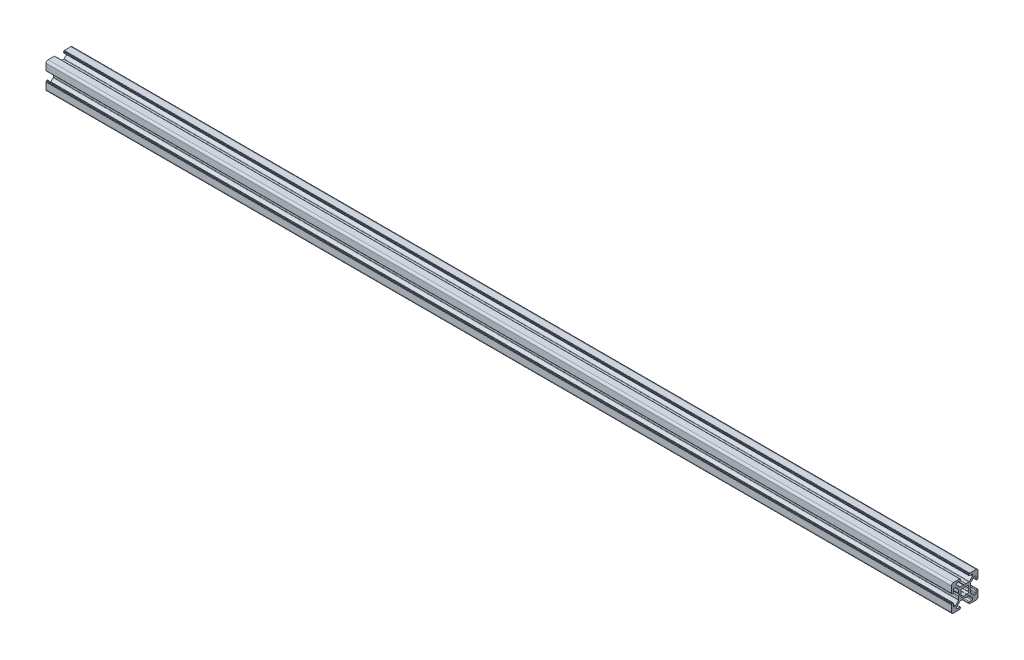
from build123d import *

# Parameters (mm, degrees)
METRIC_2020_1_DEPTH = 680


with BuildPart() as part:
    # Sketch11 → Metric 2020(1) (new body)
    with BuildSketch(Plane.YZ):
        with BuildLine():
            Line((-3.5, 8.499999673), (-5.500000686, 8.499999673))
            ThreePointArc((-5.500000686, 8.499999673), (-5.853554077, 8.353553064), (-6.000000686, 7.999999673))
            Line((-6.000000686, 7.999999673), (-6.000000686, 7.267766626))
            ThreePointArc((-6.000000686, 7.267766626), (-5.961940448, 7.076424899), (-5.853554059, 6.914213219))
            Line((-5.853554059, 6.914213219), (-3.585787212, 4.646446592))
            ThreePointArc((-3.585787212, 4.646446592), (-3.423575544, 4.538060229), (-3.232233839, 4.5))
            Line((-3.232233839, 4.5), (-0.953590312, 4.5))
            ThreePointArc((-0.953590312, 4.5), (-0.901826505, 4.493185166), (-0.853590316, 4.473205083))
            Line((-0.853590316, 4.473205083), (-0.100000045, 4.038119562))
            ThreePointArc((-0.100000045, 4.038119562), (0, 4.011324632), (0.100000045, 4.038119562))
            Line((0.100000045, 4.038119562), (0.853590316, 4.473205083))
            ThreePointArc((0.853590316, 4.473205083), (0.901826505, 4.493185166), (0.953590312, 4.5))
            Line((0.953590312, 4.5), (3.232233839, 4.5))
            ThreePointArc((3.232233839, 4.5), (3.423575544, 4.538060229), (3.585787212, 4.646446592))
            Line((3.585787212, 4.646446592), (5.853554059, 6.914213219))
            ThreePointArc((5.853554059, 6.914213219), (5.961940448, 7.076424899), (6.000000686, 7.267766626))
            Line((6.000000686, 7.267766626), (6.000000686, 7.999999673))
            ThreePointArc((6.000000686, 7.999999673), (5.853554077, 8.353553064), (5.500000686, 8.499999673))
            Line((5.500000686, 8.499999673), (3.5, 8.499999673))
            ThreePointArc((3.5, 8.499999673), (3.146446609, 8.646446283), (3, 8.999999673))
            Line((3, 8.999999673), (3, 9.3))
            ThreePointArc((3, 9.3), (3.058578644, 9.441421356), (3.2, 9.5))
            Line((3.2, 9.5), (3.350000228, 9.5))
            ThreePointArc((3.350000228, 9.5), (3.491421584, 9.558578644), (3.550000228, 9.7))
            Line((3.550000228, 9.7), (3.550000228, 9.8))
            ThreePointArc((3.550000228, 9.8), (3.608578871, 9.941421356), (3.750000228, 10))
            Line((3.750000228, 10), (8.5, 10))
            ThreePointArc((8.5, 10), (9.560660172, 9.560660172), (10, 8.5))
            Line((10, 8.5), (10, 3.749999605))
            ThreePointArc((10, 3.749999605), (9.941421356, 3.608578248), (9.8, 3.549999605))
            Line((9.8, 3.549999605), (9.699999732, 3.549999605))
            ThreePointArc((9.699999732, 3.549999605), (9.558578376, 3.491420961), (9.499999732, 3.349999605))
            Line((9.499999732, 3.349999605), (9.499999732, 3.2))
            ThreePointArc((9.499999732, 3.2), (9.441421088, 3.058578644), (9.299999732, 3))
            Line((9.299999732, 3), (8.999999732, 3))
            ThreePointArc((8.999999732, 3), (8.646446341, 3.146446609), (8.499999732, 3.5))
            Line((8.499999732, 3.5), (8.499999732, 5.499999605))
            ThreePointArc((8.499999732, 5.499999605), (8.353553123, 5.853552995), (7.999999732, 5.999999605))
            Line((7.999999732, 5.999999605), (7.267766685, 5.999999605))
            ThreePointArc((7.267766685, 5.999999605), (7.076424969, 5.961939371), (6.914213294, 5.853552995))
            Line((6.914213294, 5.853552995), (4.646446398, 3.585786099))
            ThreePointArc((4.646446398, 3.585786099), (4.538060023, 3.423574425), (4.499999789, 3.232232708))
            Line((4.499999789, 3.232232708), (4.499999789, 0.953589302))
            ThreePointArc((4.499999789, 0.953589302), (4.493184953, 0.90182549), (4.473204867, 0.853589297))
            Line((4.473204867, 0.853589297), (4.038119841, 0.099999969))
            ThreePointArc((4.038119841, 0.099999969), (4.011324929, 0), (4.038119841, -0.099999969))
            Line((4.038119841, -0.099999969), (4.473204867, -0.853589297))
            ThreePointArc((4.473204867, -0.853589297), (4.493184953, -0.90182549), (4.499999789, -0.953589302))
            Line((4.499999789, -0.953589302), (4.499999789, -3.232232708))
            ThreePointArc((4.499999789, -3.232232708), (4.538060023, -3.423574425), (4.646446398, -3.585786099))
            Line((4.646446398, -3.585786099), (6.914213294, -5.853552995))
            ThreePointArc((6.914213294, -5.853552995), (7.076424969, -5.961939371), (7.267766685, -5.999999605))
            Line((7.267766685, -5.999999605), (7.999999732, -5.999999605))
            ThreePointArc((7.999999732, -5.999999605), (8.353553123, -5.853552995), (8.499999732, -5.499999605))
            Line((8.499999732, -5.499999605), (8.499999732, -3.5))
            ThreePointArc((8.499999732, -3.5), (8.646446341, -3.146446609), (8.999999732, -3))
            Line((8.999999732, -3), (9.299999732, -3))
            ThreePointArc((9.299999732, -3), (9.441421088, -3.058578644), (9.499999732, -3.2))
            Line((9.499999732, -3.2), (9.499999732, -3.349999605))
            ThreePointArc((9.499999732, -3.349999605), (9.558578376, -3.491420961), (9.699999732, -3.549999605))
            Line((9.699999732, -3.549999605), (9.8, -3.549999605))
            ThreePointArc((9.8, -3.549999605), (9.941421356, -3.608578248), (10, -3.749999605))
            Line((10, -3.749999605), (10, -8.5))
            ThreePointArc((10, -8.5), (9.560660172, -9.560660172), (8.5, -10))
            Line((8.5, -10), (3.750000228, -10))
            ThreePointArc((3.750000228, -10), (3.608578871, -9.941421356), (3.550000228, -9.8))
            Line((3.550000228, -9.8), (3.550000228, -9.7))
            ThreePointArc((3.550000228, -9.7), (3.491421584, -9.558578644), (3.350000228, -9.5))
            Line((3.350000228, -9.5), (3.2, -9.5))
            ThreePointArc((3.2, -9.5), (3.058578644, -9.441421356), (3, -9.3))
            Line((3, -9.3), (3, -8.999999673))
            ThreePointArc((3, -8.999999673), (3.146446609, -8.646446283), (3.5, -8.499999673))
            Line((3.5, -8.499999673), (5.500000686, -8.499999673))
            ThreePointArc((5.500000686, -8.499999673), (5.853554077, -8.353553064), (6.000000686, -7.999999673))
            Line((6.000000686, -7.999999673), (6.000000686, -7.267766626))
            ThreePointArc((6.000000686, -7.267766626), (5.961940448, -7.076424899), (5.853554059, -6.914213219))
            Line((5.853554059, -6.914213219), (3.585787212, -4.646446592))
            ThreePointArc((3.585787212, -4.646446592), (3.423575544, -4.538060229), (3.232233839, -4.5))
            Line((3.232233839, -4.5), (0.953590312, -4.5))
            ThreePointArc((0.953590312, -4.5), (0.901826505, -4.493185166), (0.853590316, -4.473205083))
            Line((0.853590316, -4.473205083), (0.100000045, -4.038119562))
            ThreePointArc((0.100000045, -4.038119562), (0, -4.011324632), (-0.100000045, -4.038119562))
            Line((-0.100000045, -4.038119562), (-0.853590316, -4.473205083))
            ThreePointArc((-0.853590316, -4.473205083), (-0.901826505, -4.493185166), (-0.953590312, -4.5))
            Line((-0.953590312, -4.5), (-3.232233839, -4.5))
            ThreePointArc((-3.232233839, -4.5), (-3.423575544, -4.538060229), (-3.585787212, -4.646446592))
            Line((-3.585787212, -4.646446592), (-5.853554059, -6.914213219))
            ThreePointArc((-5.853554059, -6.914213219), (-5.961940448, -7.076424899), (-6.000000686, -7.267766626))
            Line((-6.000000686, -7.267766626), (-6.000000686, -7.999999673))
            ThreePointArc((-6.000000686, -7.999999673), (-5.853554077, -8.353553064), (-5.500000686, -8.499999673))
            Line((-5.500000686, -8.499999673), (-3.5, -8.499999673))
            ThreePointArc((-3.5, -8.499999673), (-3.146446609, -8.646446283), (-3, -8.999999673))
            Line((-3, -8.999999673), (-3, -9.3))
            ThreePointArc((-3, -9.3), (-3.058578644, -9.441421356), (-3.2, -9.5))
            Line((-3.2, -9.5), (-3.350000228, -9.5))
            ThreePointArc((-3.350000228, -9.5), (-3.491421584, -9.558578644), (-3.550000228, -9.7))
            Line((-3.550000228, -9.7), (-3.550000228, -9.8))
            ThreePointArc((-3.550000228, -9.8), (-3.608578871, -9.941421356), (-3.750000228, -10))
            Line((-3.750000228, -10), (-8.5, -10))
            ThreePointArc((-8.5, -10), (-9.560660172, -9.560660172), (-10, -8.5))
            Line((-10, -8.5), (-10, -3.749999605))
            ThreePointArc((-10, -3.749999605), (-9.941421356, -3.608578248), (-9.8, -3.549999605))
            Line((-9.8, -3.549999605), (-9.699999732, -3.549999605))
            ThreePointArc((-9.699999732, -3.549999605), (-9.558578376, -3.491420961), (-9.499999732, -3.349999605))
            Line((-9.499999732, -3.349999605), (-9.499999732, -3.2))
            ThreePointArc((-9.499999732, -3.2), (-9.441421088, -3.058578644), (-9.299999732, -3))
            Line((-9.299999732, -3), (-8.999999732, -3))
            ThreePointArc((-8.999999732, -3), (-8.646446341, -3.146446609), (-8.499999732, -3.5))
            Line((-8.499999732, -3.5), (-8.499999732, -5.499999605))
            ThreePointArc((-8.499999732, -5.499999605), (-8.353553123, -5.853552995), (-7.999999732, -5.999999605))
            Line((-7.999999732, -5.999999605), (-7.267766685, -5.999999605))
            ThreePointArc((-7.267766685, -5.999999605), (-7.076424969, -5.961939371), (-6.914213294, -5.853552995))
            Line((-6.914213294, -5.853552995), (-4.646446398, -3.585786099))
            ThreePointArc((-4.646446398, -3.585786099), (-4.538060023, -3.423574425), (-4.499999789, -3.232232708))
            Line((-4.499999789, -3.232232708), (-4.499999789, -0.953589302))
            ThreePointArc((-4.499999789, -0.953589302), (-4.493184953, -0.90182549), (-4.473204867, -0.853589297))
            Line((-4.473204867, -0.853589297), (-4.038119841, -0.099999969))
            ThreePointArc((-4.038119841, -0.099999969), (-4.011324929, 0), (-4.038119841, 0.099999969))
            Line((-4.038119841, 0.099999969), (-4.473204867, 0.853589297))
            ThreePointArc((-4.473204867, 0.853589297), (-4.493184953, 0.90182549), (-4.499999789, 0.953589302))
            Line((-4.499999789, 0.953589302), (-4.499999789, 3.232232708))
            ThreePointArc((-4.499999789, 3.232232708), (-4.538060023, 3.423574425), (-4.646446398, 3.585786099))
            Line((-4.646446398, 3.585786099), (-6.914213294, 5.853552995))
            ThreePointArc((-6.914213294, 5.853552995), (-7.076424969, 5.961939371), (-7.267766685, 5.999999605))
            Line((-7.267766685, 5.999999605), (-7.999999732, 5.999999605))
            ThreePointArc((-7.999999732, 5.999999605), (-8.353553123, 5.853552995), (-8.499999732, 5.499999605))
            Line((-8.499999732, 5.499999605), (-8.499999732, 3.5))
            ThreePointArc((-8.499999732, 3.5), (-8.646446341, 3.146446609), (-8.999999732, 3))
            Line((-8.999999732, 3), (-9.299999732, 3))
            ThreePointArc((-9.299999732, 3), (-9.441421088, 3.058578644), (-9.499999732, 3.2))
            Line((-9.499999732, 3.2), (-9.499999732, 3.349999605))
            ThreePointArc((-9.499999732, 3.349999605), (-9.558578376, 3.491420961), (-9.699999732, 3.549999605))
            Line((-9.699999732, 3.549999605), (-9.8, 3.549999605))
            ThreePointArc((-9.8, 3.549999605), (-9.941421356, 3.608578248), (-10, 3.749999605))
            Line((-10, 3.749999605), (-10, 8.5))
            ThreePointArc((-10, 8.5), (-9.560660172, 9.560660172), (-8.5, 10))
            Line((-8.5, 10), (-3.750000228, 10))
            ThreePointArc((-3.750000228, 10), (-3.608578871, 9.941421356), (-3.550000228, 9.8))
            Line((-3.550000228, 9.8), (-3.550000228, 9.7))
            ThreePointArc((-3.550000228, 9.7), (-3.491421584, 9.558578644), (-3.350000228, 9.5))
            Line((-3.350000228, 9.5), (-3.2, 9.5))
            ThreePointArc((-3.2, 9.5), (-3.058578644, 9.441421356), (-3, 9.3))
            Line((-3, 9.3), (-3, 8.999999673))
            ThreePointArc((-3, 8.999999673), (-3.146446609, 8.646446283), (-3.5, 8.499999673))
        make_face()
        with BuildLine():
            Line((-1.258185436, 2.445295362), (-1.91389502, 2.989640962))
            ThreePointArc((-1.91389502, 2.989640962), (-2.511737261, 2.508410485), (-2.992174953, 1.909930962))
            Line((-2.992174953, 1.909930962), (-2.445295423, 1.258185317))
            ThreePointArc((-2.445295423, 1.258185317), (-2.75, 0), (-2.445295423, -1.258185317))
            Line((-2.445295423, -1.258185317), (-2.992174953, -1.909930962))
            ThreePointArc((-2.992174953, -1.909930962), (-2.511737261, -2.508410485), (-1.91389502, -2.989640962))
            Line((-1.91389502, -2.989640962), (-1.258185436, -2.445295362))
            ThreePointArc((-1.258185436, -2.445295362), (0, -2.75), (1.258185436, -2.445295362))
            Line((1.258185436, -2.445295362), (1.91389502, -2.989640962))
            ThreePointArc((1.91389502, -2.989640962), (2.511737261, -2.508410485), (2.992174953, -1.909930962))
            Line((2.992174953, -1.909930962), (2.445295423, -1.258185317))
            ThreePointArc((2.445295423, -1.258185317), (2.75, 0), (2.445295423, 1.258185317))
            Line((2.445295423, 1.258185317), (2.992174953, 1.909930962))
            ThreePointArc((2.992174953, 1.909930962), (2.511737261, 2.508410485), (1.91389502, 2.989640962))
            Line((1.91389502, 2.989640962), (1.258185436, 2.445295362))
            ThreePointArc((1.258185436, 2.445295362), (0, 2.75), (-1.258185436, 2.445295362))
        make_face(mode=Mode.SUBTRACT)
    extrude(amount=METRIC_2020_1_DEPTH)


solid = part.part
